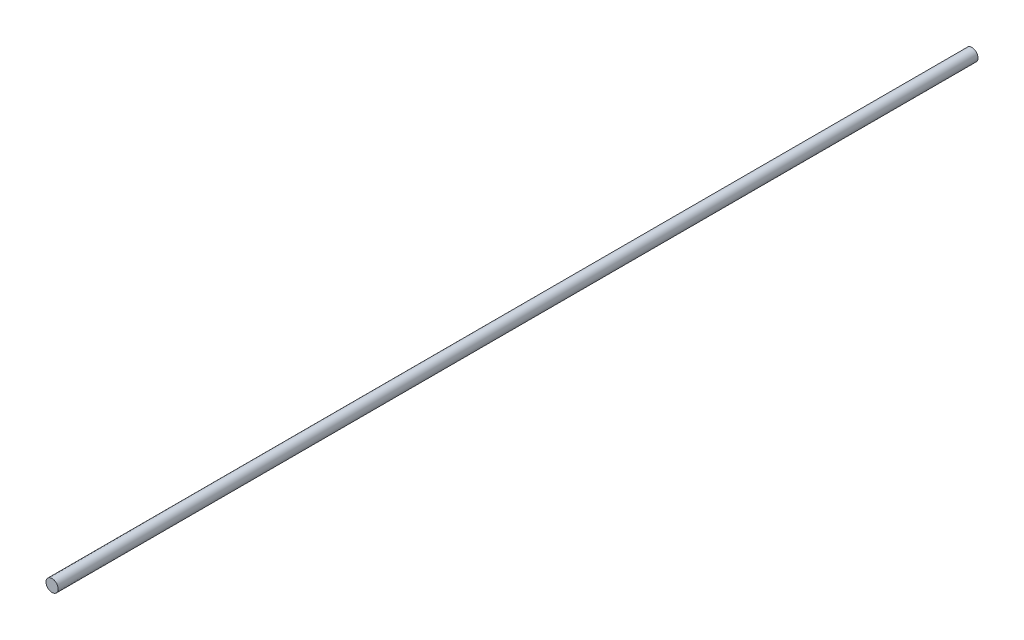
from build123d import *

# Parameters (mm, degrees)
SKETCH2_R           = 1.985
BOSS_EXTRUDE1_DEPTH = 300


with BuildPart() as part:
    # Sketch2 → Boss-Extrude1 (new body)
    with BuildSketch(Plane.XY):
        Circle(SKETCH2_R)
    extrude(amount=BOSS_EXTRUDE1_DEPTH)


solid = part.part
